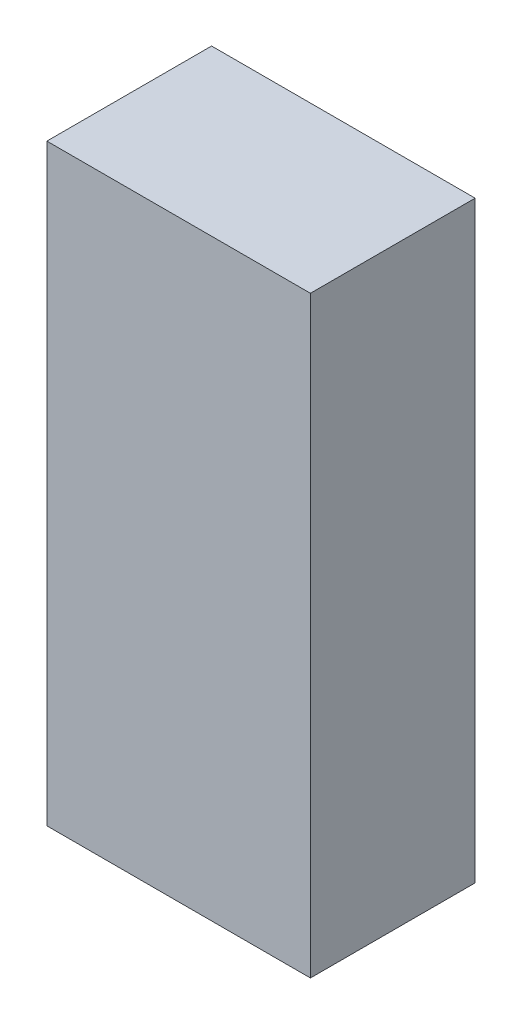
from build123d import *

# Parameters (mm, degrees)
SKETCH1_W           = 25.4
SKETCH1_H           = 15.875
BOSS_EXTRUDE1_DEPTH = 57.15


with BuildPart() as part:
    # Sketch1 → Boss-Extrude1 (new body)
    with BuildSketch(Plane(origin=(0, 0, 0), x_dir=(1, 0, 0), z_dir=(0, 1, 0))):
        Rectangle(SKETCH1_W, SKETCH1_H)
    extrude(amount=BOSS_EXTRUDE1_DEPTH)


solid = part.part
